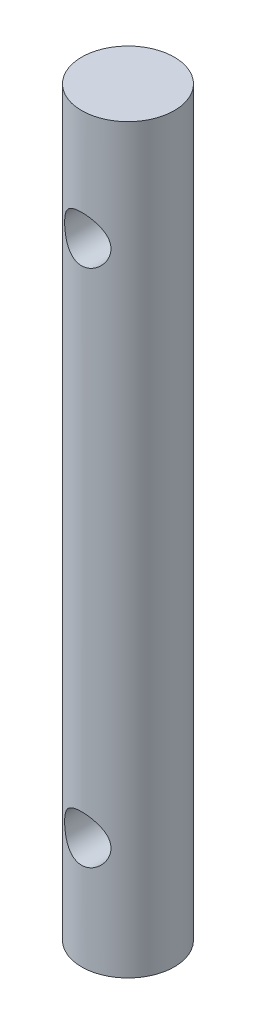
from build123d import *

# Parameters (mm, degrees)
SKETCH1_R               = 3.175
BOSS_EXTRUDE1_DEPTH     = 50.8
CUT_EXTRUDE1_DEPTH      = 12.192
CUT_EXTRUDE1_DEPTH_BACK = 11.176
SKETCH2_R               = 1.5875
CUT_EXTRUDE2_DEPTH      = 11.176
CUT_EXTRUDE2_DEPTH_BACK = 11.176
SKETCH3_R               = 1.5875


with BuildPart() as part:
    # Sketch1 → Boss-Extrude1 (new body)
    with BuildSketch(Plane(origin=(0, 0, 0), x_dir=(1, 0, 0), z_dir=(0, 1, 0))):
        with Locations(Location((0, 0, 0), (0, 0, 270))):
            Circle(SKETCH1_R)
    extrude(amount=BOSS_EXTRUDE1_DEPTH)

    # Sketch2 → Cut-Extrude1 (cut, two sides: drawn at the far end of the back side and taken through both)
    with BuildSketch(Plane.XY.offset(-CUT_EXTRUDE1_DEPTH_BACK)):
        with Locations(Location((0, 43.18, 0), (0, 0, 89.99999999))):
            Circle(SKETCH2_R)
    extrude(amount=CUT_EXTRUDE1_DEPTH + CUT_EXTRUDE1_DEPTH_BACK, mode=Mode.SUBTRACT)

    # Sketch3 → Cut-Extrude2 (cut, two sides: drawn at the far end of the back side and taken through both)
    with BuildSketch(Plane.XY.offset(-CUT_EXTRUDE2_DEPTH_BACK)):
        with Locations(Location((0, 7.62, 0), (0, 0, 89.99999999))):
            Circle(SKETCH3_R)
    extrude(amount=CUT_EXTRUDE2_DEPTH + CUT_EXTRUDE2_DEPTH_BACK, mode=Mode.SUBTRACT)


solid = part.part
